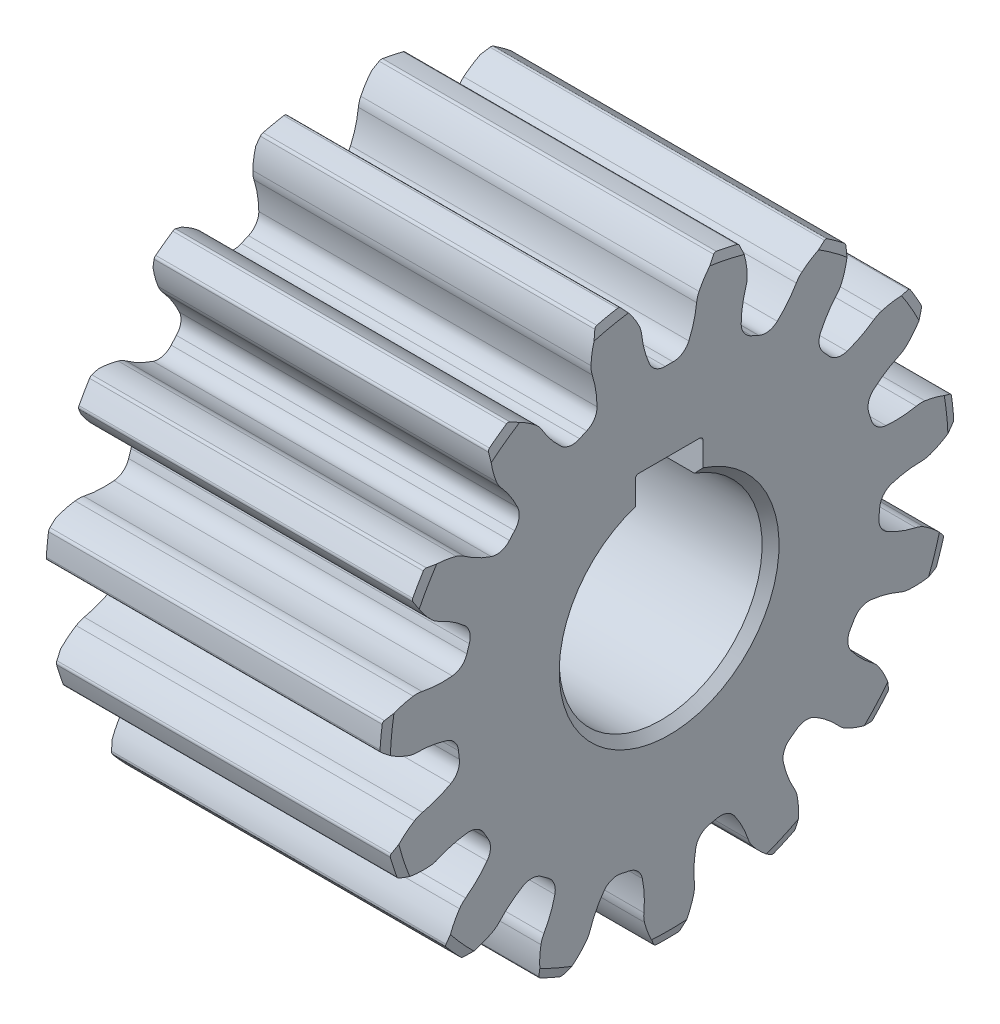
from build123d import *

# Parameters (mm, degrees)
CHAMFER1_SIZE      = 0.5
CUT_EXTRUDE1_DEPTH = 32.272991542
CIRPATTERN1_COUNT  = 15
CUT_EXTRUDE2_DEPTH = 32.251928657


with BuildPart() as part:
    # Sketch1 → Revolve1 (revolve)
    with BuildSketch(Plane.XY, mode=Mode.PRIVATE) as revolve1_sk:
        Polygon((0, 6), (0, 16.5), (0.133974596, 17), (19.866025404, 17), (20, 16.5), (20, 6), align=None)
    revolve(revolve1_sk.sketch.rotate(Axis((0, 0, 0), (1, 0, 0)), 90), axis=Axis((0, 0, 0), (1, 0, 0)))

    # Chamfer1
    chamfer1_edges = [part.edges().sort_by_distance(p)[0] for p in [
        (20, 0, -6),
        (0, 0, -6),
    ]]
    chamfer(chamfer1_edges, length=CHAMFER1_SIZE)

    # Sketch2 → Cut-Extrude1 (cut, through all)
    with BuildSketch(Plane(origin=(0, 0, 0), x_dir=(0, 0, -1), z_dir=(1, 0, 0))):
        with BuildLine():
            ThreePointArc((1.167556141, 13.100459852), (1.461960001, 13.95033257), (1.626015607, 14.834664537))
            ThreePointArc((1.626015607, 14.834664537), (1.676131495, 15.088735933), (1.769159726, 15.330416766))
            ThreePointArc((1.769159726, 15.330416766), (2.200062293, 16.052575643), (2.745899369, 16.692303986))
            ThreePointArc((2.745899369, 16.692303986), (2.826763036, 16.740996881), (2.920952742, 16.747179914))
            ThreePointArc((2.920952742, 16.747179914), (0, 17), (-2.920952742, 16.747179914))
            ThreePointArc((-2.920952742, 16.747179914), (-2.826763036, 16.740996881), (-2.745899369, 16.692303986))
            ThreePointArc((-2.745899369, 16.692303986), (-2.200062293, 16.052575643), (-1.769159726, 15.330416766))
            ThreePointArc((-1.769159726, 15.330416766), (-1.676131495, 15.088735933), (-1.626015607, 14.834664537))
            ThreePointArc((-1.626015607, 14.834664537), (-1.461960001, 13.95033257), (-1.167556141, 13.100459852))
            ThreePointArc((-1.167556141, 13.100459852), (-0.791064574, 12.656812338), (-0.231329869, 12.497859276))
            ThreePointArc((-0.231329869, 12.497859276), (0, 12.5), (0.231329869, 12.497859276))
            ThreePointArc((0.231329869, 12.497859276), (0.791064574, 12.656812338), (1.167556141, 13.100459852))
        make_face()
    cut_extrude1 = extrude(amount=CUT_EXTRUDE1_DEPTH, mode=Mode.SUBTRACT)

    # CirPattern1: Cut-Extrude1 ×15 about axis
    cirpattern1_axis = Axis((0, 0, 0), (1, 0, 0))
    for i in range(1, CIRPATTERN1_COUNT):
        add(cut_extrude1.rotate(cirpattern1_axis, i * 360 / CIRPATTERN1_COUNT), mode=Mode.SUBTRACT)

    # Sketch3 → Cut-Extrude2 (cut, through all)
    with BuildSketch(Plane.ZY):
        with BuildLine():
            Line((-2, 0), (2, 0))
            Line((2, 0), (2, 7.6))
            ThreePointArc((2, 7.6), (1.941421356, 7.741421356), (1.8, 7.8))
            Line((1.8, 7.8), (-1.8, 7.8))
            ThreePointArc((-1.8, 7.8), (-1.941421356, 7.741421356), (-2, 7.6))
            Line((-2, 7.6), (-2, 0))
        make_face()
    extrude(amount=-CUT_EXTRUDE2_DEPTH, mode=Mode.SUBTRACT)


solid = part.part
